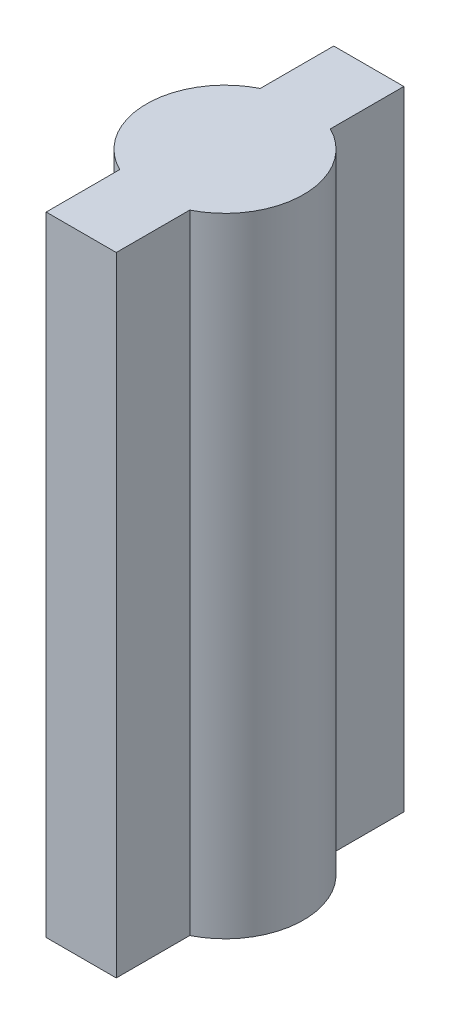
from build123d import *

# Parameters (mm, degrees)
BOSS_EXTRUDE1_DEPTH = 6.5


with BuildPart() as part:
    # Sketch1 → Boss-Extrude1 (new, symmetric)
    with BuildSketch(Plane(origin=(0, 0, 0), x_dir=(1, 0, 0), z_dir=(0, 1, 0))):
        with BuildLine():
            ThreePointArc((1.625, 0), (1.381801361, 0.855131569), (0.725, 1.454303957))
            Line((0.725, 1.454303957), (0.725, -1.454303957))
            ThreePointArc((0.725, -1.454303957), (1.381801361, -0.855131569), (1.625, 0))
        make_face()
        with BuildLine():
            ThreePointArc((0.725, 1.454303957), (0, 1.625), (-0.725, 1.454303957))
            Line((-0.725, 1.454303957), (-0.725, -1.454303957))
            ThreePointArc((-0.725, -1.454303957), (0, -1.625), (0.725, -1.454303957))
            Line((0.725, -1.454303957), (0.725, 1.454303957))
        make_face()
        with BuildLine():
            Line((-0.725, -1.454303957), (-0.725, 1.454303957))
            ThreePointArc((-0.725, 1.454303957), (-1.625, 0), (-0.725, -1.454303957))
        make_face()
        with BuildLine():
            Line((0.725, 2.975), (-0.725, 2.975))
            Line((-0.725, 2.975), (-0.725, 1.454303957))
            ThreePointArc((-0.725, 1.454303957), (0, 1.625), (0.725, 1.454303957))
            Line((0.725, 1.454303957), (0.725, 2.975))
        make_face()
        with BuildLine():
            ThreePointArc((0.725, -1.454303957), (0, -1.625), (-0.725, -1.454303957))
            Line((-0.725, -1.454303957), (-0.725, -2.975))
            Line((-0.725, -2.975), (0.725, -2.975))
            Line((0.725, -2.975), (0.725, -1.454303957))
        make_face()
    extrude(amount=BOSS_EXTRUDE1_DEPTH, both=True)


solid = part.part
